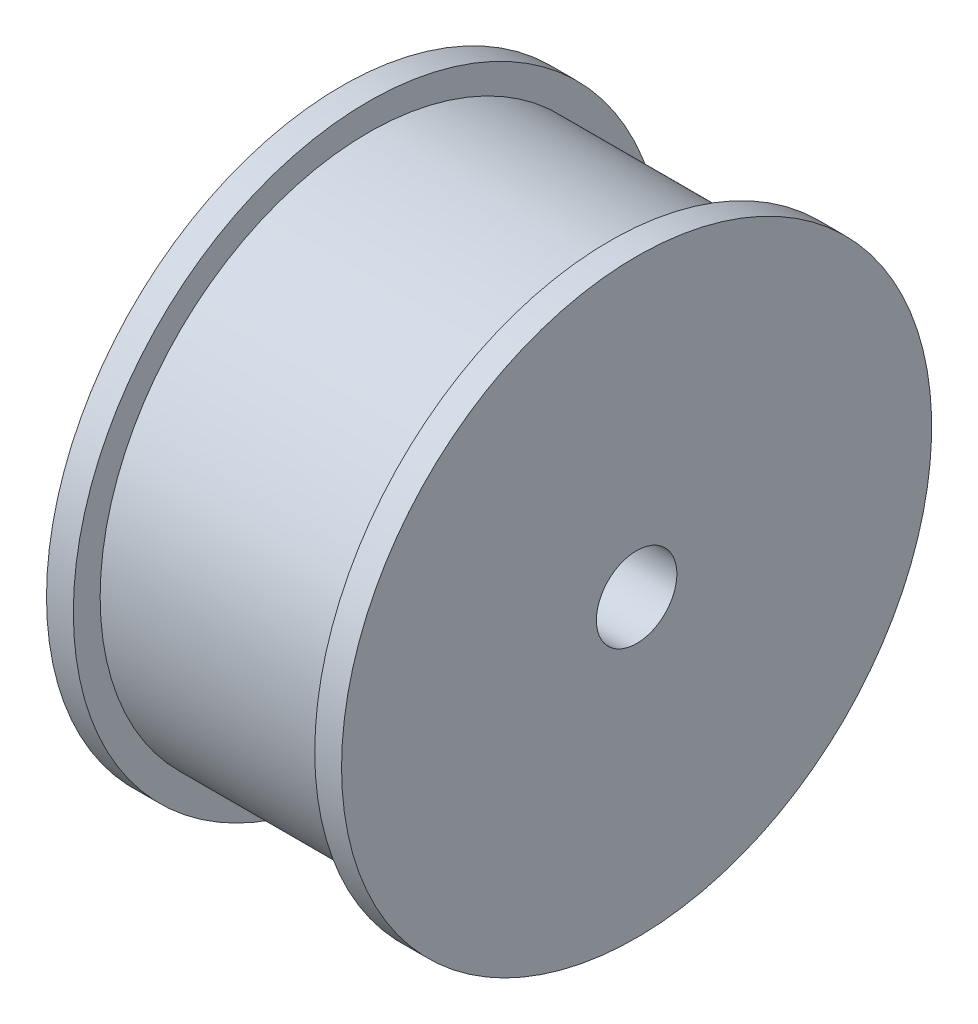
from build123d import *


with BuildPart() as part:
    # Sketch1 → Revolve1 (revolve)
    with BuildSketch(Plane(origin=(0, 0, 0), x_dir=(1, 0, 0), z_dir=(0, 1, 0)), mode=Mode.PRIVATE) as revolve1_sk:
        Polygon((0, 1.5), (0, 11), (1, 11), (1, 10), (10, 10), (10, 11), (11, 11), (11, 1.5), align=None)
    revolve(revolve1_sk.sketch.rotate(Axis((0, 0, 0), (1, 0, 0)), 180), axis=Axis((0, 0, 0), (1, 0, 0)))


solid = part.part
